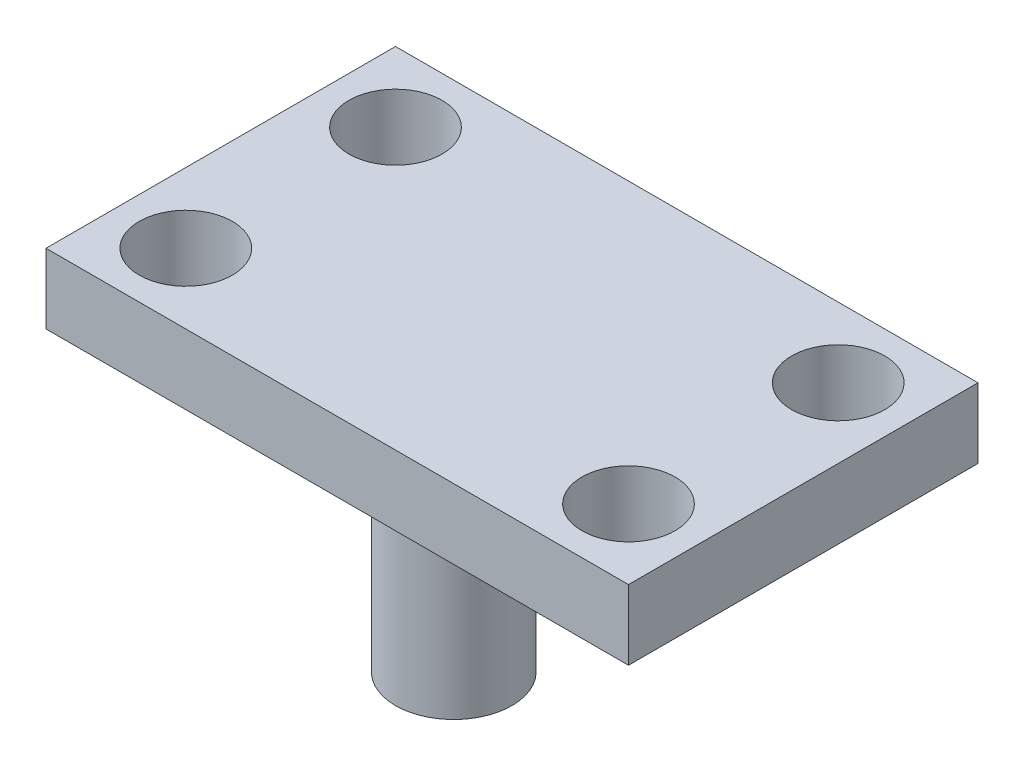
from build123d import *

# Parameters (mm, degrees)
SKETCH1_W           = 250
SKETCH1_H           = 150
SKETCH1_R           = 25
SKETCH1_R_2         = 20
BOSS_EXTRUDE1_DEPTH = 30
SKETCH1_3_R         = 25
BOSS_EXTRUDE2_DEPTH = 30
SKETCH1_4_R         = 25
BOSS_EXTRUDE3_DEPTH = 90


with BuildPart() as part:
    # Sketch1 → Boss-Extrude1 (new body)
    with BuildSketch(Plane(origin=(0, 0, 0), x_dir=(1, 0, 0), z_dir=(0, 1, 0))):
        Rectangle(SKETCH1_W, SKETCH1_H)
        with Locations(Location((0, -25, 0), (0, 0, 270))):
            Circle(SKETCH1_R, mode=Mode.SUBTRACT)
        with Locations(Location((-95, -45, 0), (0, 0, 270))):
            Circle(SKETCH1_R_2, mode=Mode.SUBTRACT)
        with Locations(Location((-95, 45, 0), (0, 0, 270))):
            Circle(SKETCH1_R_2, mode=Mode.SUBTRACT)
        with Locations(Location((95, 45, 0), (0, 0, 270))):
            Circle(SKETCH1_R_2, mode=Mode.SUBTRACT)
        with Locations(Location((95, -45, 0), (0, 0, 270))):
            Circle(SKETCH1_R_2, mode=Mode.SUBTRACT)
    extrude(amount=BOSS_EXTRUDE1_DEPTH)

    # Sketch1<3> → Boss-Extrude2 (add, through all)
    with BuildSketch(Plane(origin=(0, 0, 0), x_dir=(1, 0, 0), z_dir=(0, 1, 0))):
        with Locations((0, -25)):
            Circle(SKETCH1_3_R)
    extrude(amount=BOSS_EXTRUDE2_DEPTH)

    # Sketch1<4> → Boss-Extrude3 (add)
    with BuildSketch(Plane(origin=(0, 0, 0), x_dir=(1, 0, 0), z_dir=(0, 1, 0))):
        with Locations(Location((0, -25, 0), (0, 0, 270))):
            Circle(SKETCH1_4_R)
    extrude(amount=-BOSS_EXTRUDE3_DEPTH)


solid = part.part
